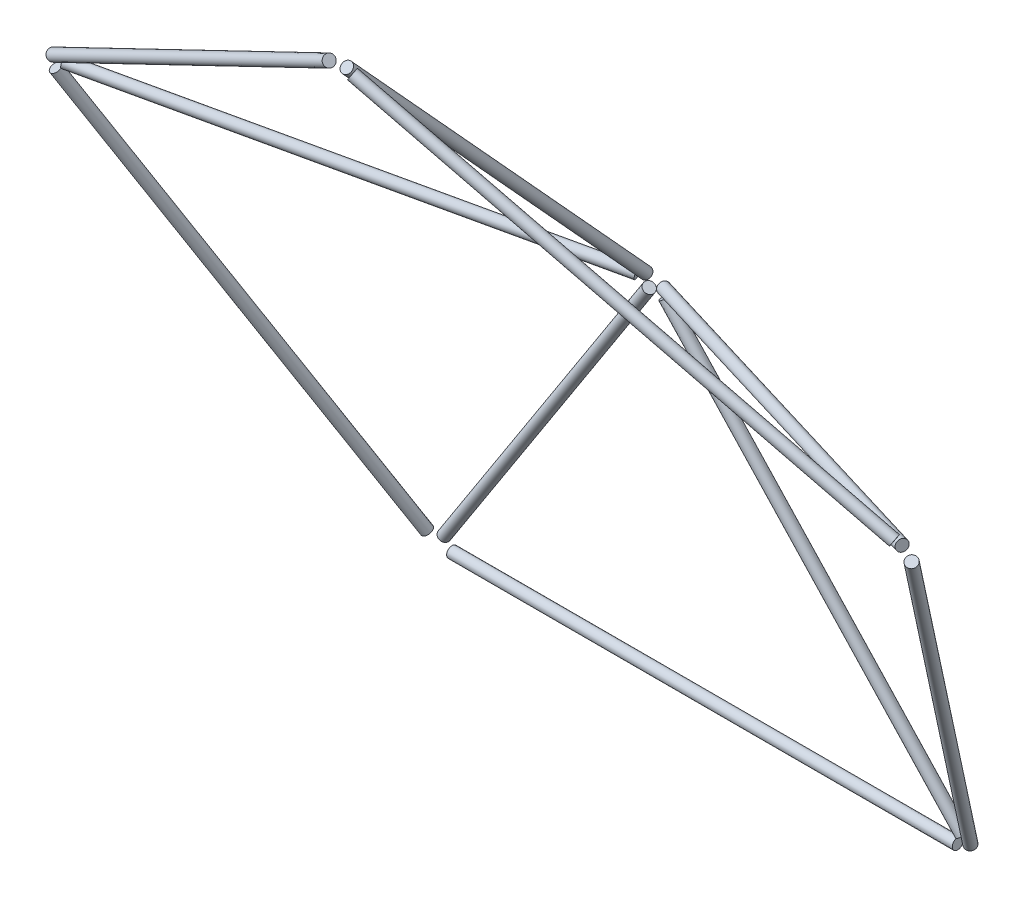
from build123d import *

# Parameters (mm, degrees)
SKETCH20_R        = 1.5
SKETCH21_R        = 1.5
CIRPATTERN7_COUNT = 5
CIRPATTERN8_COUNT = 5


with BuildPart() as part:
    # Sweep4: sweep along a path in Sketch16
    with BuildLine(Plane(origin=(71.35154116, 74.813981292, -201.467891676), x_dir=(-0.9490605003608429, 0.10968961318168566, -0.2953850968056427), z_dir=(0.3150939013291542, 0.3303843036360469, -0.8896977269028498))) as sweep4_path:
        Line((72.798191909, 22.677431961), (-0.580452741, -76.246349028))
    # Sketch20 → Sweep4 (sweep)
    with BuildSketch(Plane(origin=(2.261652721, 104.058168353, -215.076988054), x_dir=(-0.8248078173251137, -0.5609339440894788, -0.07102939425057496), z_dir=(0.5654131803198278, -0.8182736416337228, -0.10361555350478845))):
        Circle(SKETCH20_R)
    sweep(path=sweep4_path.line)


with BuildPart() as body_2:
    # Sweep5: sweep along a path in Sketch6
    with BuildLine(Plane(origin=(0, 91.301425564, -182.602851129), x_dir=(-1, 0, 0), z_dir=(0, 0.44721359549995754, -0.8944271909999162))) as sweep5_path:
        Line((-118.763932023, 35.186137483), (-75.400146627, -98.273870937))
    # Sketch21 → Sweep5 (sweep)
    with BuildSketch(Plane(origin=(75.400146627, 3.402603233, -226.552262294), x_dir=(-0.9510565162951541, 0.2763932022500199, 0.1381966011250097), z_dir=(-0.309016994374946, -0.8506508083520407, -0.42532540417601955))):
        Circle(SKETCH21_R)
    sweep(path=sweep5_path.line)


with BuildPart() as cirpattern7_1:
    # CirPattern7: pattern copy
    add(part.part.rotate(Axis((0, 91.301425564, -182.602851129), (1.3257972884873299e-15, 0.4472135954999564, -0.8944271909999166)), 1 * 360 / CIRPATTERN7_COUNT))


with BuildPart() as cirpattern7_2:
    # CirPattern7: pattern copy
    add(part.part.rotate(Axis((0, 91.301425564, -182.602851129), (1.3257972884873299e-15, 0.4472135954999564, -0.8944271909999166)), 2 * 360 / CIRPATTERN7_COUNT))


with BuildPart() as cirpattern7_3:
    # CirPattern7: pattern copy
    add(part.part.rotate(Axis((0, 91.301425564, -182.602851129), (1.3257972884873299e-15, 0.4472135954999564, -0.8944271909999166)), 3 * 360 / CIRPATTERN7_COUNT))


with BuildPart() as cirpattern7_4:
    # CirPattern7: pattern copy
    add(part.part.rotate(Axis((0, 91.301425564, -182.602851129), (1.3257972884873299e-15, 0.4472135954999564, -0.8944271909999166)), 4 * 360 / CIRPATTERN7_COUNT))


with BuildPart() as cirpattern8_1:
    # CirPattern8: pattern copy
    add(body_2.part.rotate(Axis((0, 0, 0), (1.8969560526684615e-15, 0.44721359549995676, -0.8944271909999165)), 1 * 360 / CIRPATTERN8_COUNT))


with BuildPart() as cirpattern8_2:
    # CirPattern8: pattern copy
    add(body_2.part.rotate(Axis((0, 0, 0), (1.8969560526684615e-15, 0.44721359549995676, -0.8944271909999165)), 2 * 360 / CIRPATTERN8_COUNT))


with BuildPart() as cirpattern8_3:
    # CirPattern8: pattern copy
    add(body_2.part.rotate(Axis((0, 0, 0), (1.8969560526684615e-15, 0.44721359549995676, -0.8944271909999165)), 3 * 360 / CIRPATTERN8_COUNT))


with BuildPart() as cirpattern8_4:
    # CirPattern8: pattern copy
    add(body_2.part.rotate(Axis((0, 0, 0), (1.8969560526684615e-15, 0.44721359549995676, -0.8944271909999165)), 4 * 360 / CIRPATTERN8_COUNT))


solid = Compound([part.part, body_2.part, cirpattern7_1.part, cirpattern7_2.part, cirpattern7_3.part, cirpattern7_4.part, cirpattern8_1.part, cirpattern8_2.part, cirpattern8_3.part, cirpattern8_4.part])
